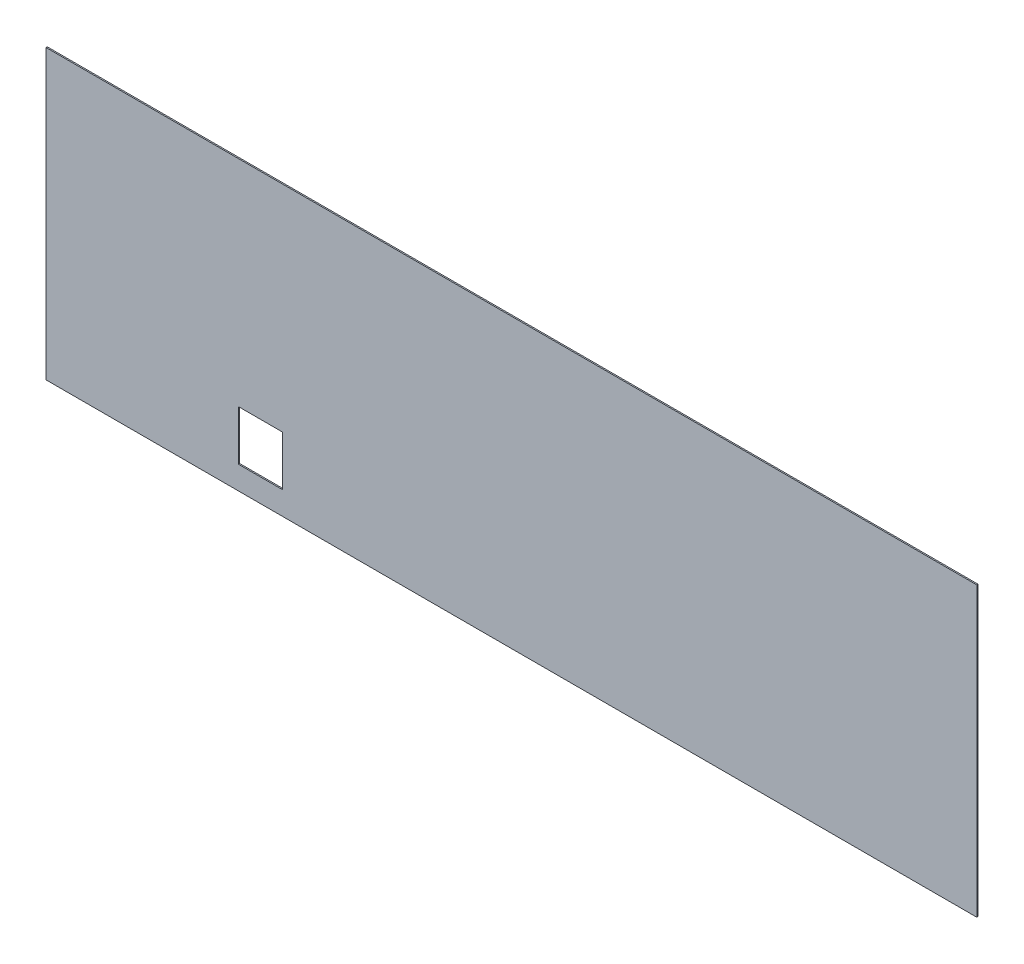
from build123d import *

# Parameters (mm, degrees)
SKETCH1_W           = 747
SKETCH1_H           = 231
BOSS_EXTRUDE1_DEPTH = 1
SKETCH2_W           = 35.382353291
SKETCH2_H           = 40.041525185
CUT_EXTRUDE1_DEPTH  = 10


with BuildPart() as part:
    # Sketch1 → Boss-Extrude1 (new body)
    with BuildSketch(Plane.XY):
        with Locations((373.5, 115.5)):
            Rectangle(SKETCH1_W, SKETCH1_H)
    extrude(amount=BOSS_EXTRUDE1_DEPTH)

    # Sketch2 → Cut-Extrude1 (cut)
    with BuildSketch(Plane(origin=(0, 0, 0), x_dir=(-1, 0, 0), z_dir=(0, 0, -1))):
        with Locations((-172.071282368, 38.601136184)):
            Rectangle(SKETCH2_W, SKETCH2_H)
    extrude(amount=-CUT_EXTRUDE1_DEPTH, mode=Mode.SUBTRACT)


solid = part.part
